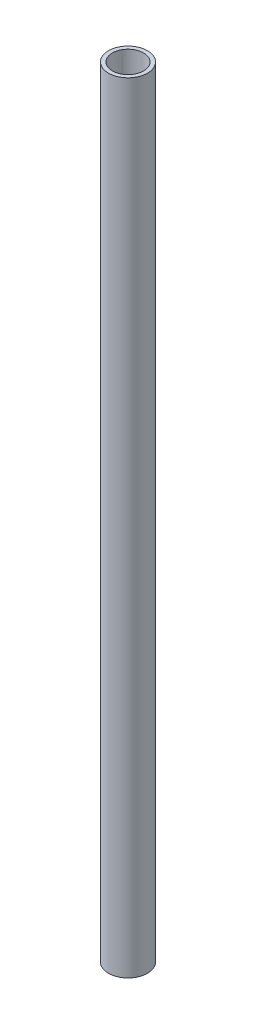
from build123d import *

# Parameters (mm, degrees)
SKETCH1_R           = 2.5
SKETCH1_R_2         = 2
BOSS_EXTRUDE1_DEPTH = 100


with BuildPart() as part:
    # Sketch1 → Boss-Extrude1 (new body)
    with BuildSketch(Plane(origin=(0, 0, 0), x_dir=(1, 0, 0), z_dir=(0, 1, 0))):
        with Locations(Location((0, 0, 0), (0, 0, 270))):
            Circle(SKETCH1_R)
        with Locations(Location((0, 0, 0), (0, 0, 270))):
            Circle(SKETCH1_R_2, mode=Mode.SUBTRACT)
    extrude(amount=BOSS_EXTRUDE1_DEPTH)


solid = part.part
